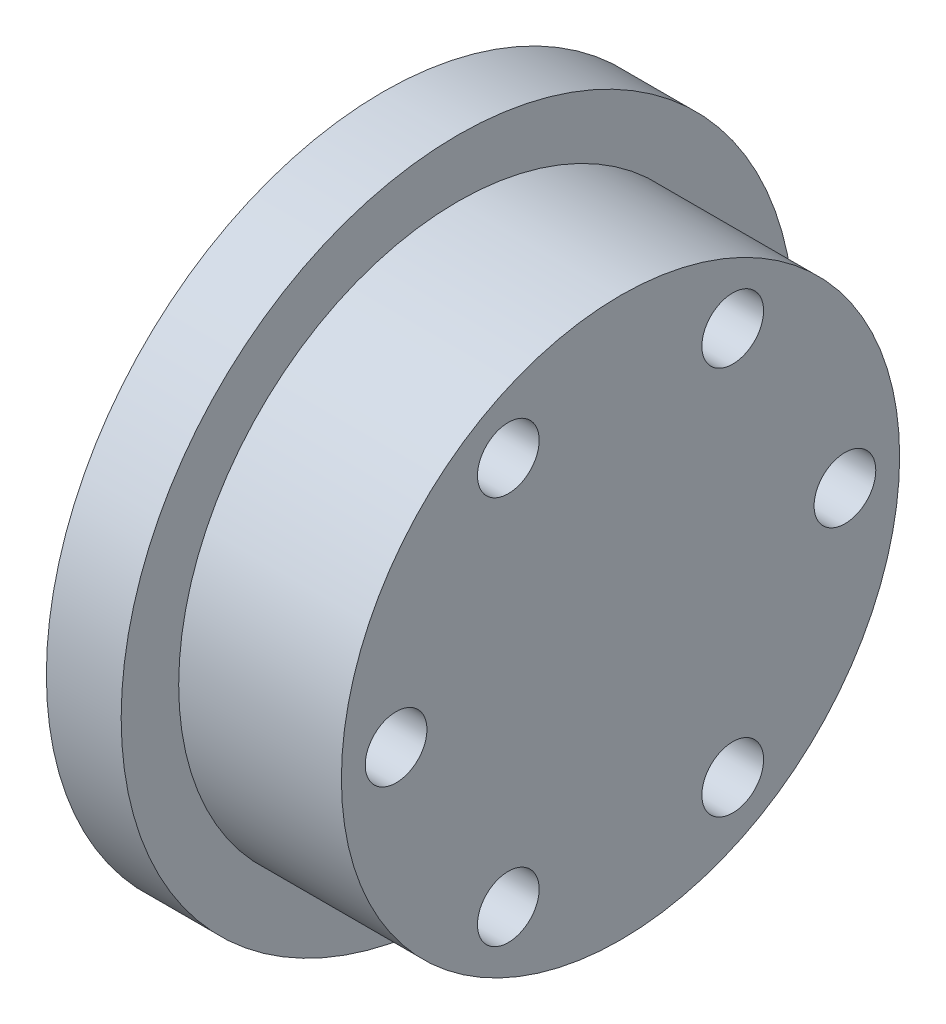
from build123d import *

# Parameters (mm, degrees)
SKETCH1_R           = 18
BOSS_EXTRUDE1_DEPTH = 4
SKETCH2_R           = 14.925
BOSS_EXTRUDE2_DEPTH = 8.7
SKETCH3_R           = 1.65
CUT_EXTRUDE1_DEPTH  = 29.448022778


with BuildPart() as part:
    # Sketch1 → Boss-Extrude1 (new body)
    with BuildSketch(Plane.YZ):
        with Locations(Location((0, 0, 0), (0, 0, 270))):
            Circle(SKETCH1_R)
    extrude(amount=BOSS_EXTRUDE1_DEPTH)

    # Sketch2 → Boss-Extrude2 (add)
    with BuildSketch(Plane.YZ.offset(4)):
        with Locations(Location((0, 0, 0), (0, 0, 270))):
            Circle(SKETCH2_R)
    extrude(amount=BOSS_EXTRUDE2_DEPTH)

    # Sketch3 → Cut-Extrude1 (cut, through all)
    with BuildSketch(Plane.YZ.offset(12.7)):
        with Locations(Location((0, 12, 0), (0, 0, 270))):
            Circle(SKETCH3_R)
        with Locations(Location((10.392304845, 6, 0), (0, 0, 270))):
            Circle(SKETCH3_R)
        with Locations(Location((10.392304845, -6, 0), (0, 0, 270))):
            Circle(SKETCH3_R)
        with Locations(Location((0, -12, 0), (0, 0, 270))):
            Circle(SKETCH3_R)
        with Locations(Location((-10.392304845, -6, 0), (0, 0, 270))):
            Circle(SKETCH3_R)
        with Locations(Location((-10.392304845, 6, 0), (0, 0, 270))):
            Circle(SKETCH3_R)
    extrude(amount=-CUT_EXTRUDE1_DEPTH, mode=Mode.SUBTRACT)


solid = part.part
